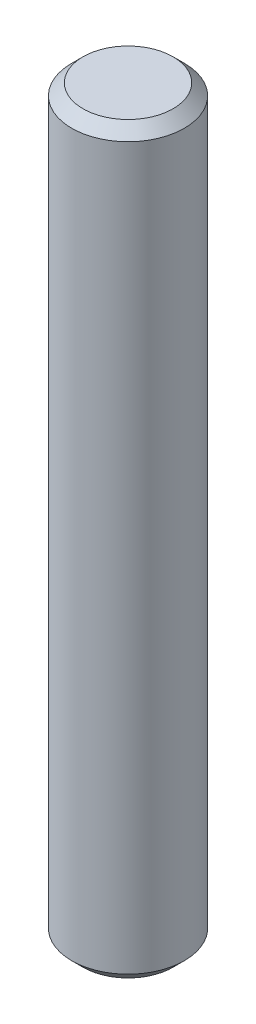
from build123d import *

# Parameters (mm, degrees)
SKETCH1_R           = 3.175
BOSS_EXTRUDE1_DEPTH = 41.91
CHAMFER1_SIZE       = 0.635


with BuildPart() as part:
    # Sketch1 → Boss-Extrude1 (new body)
    with BuildSketch(Plane(origin=(0, 0, 0), x_dir=(1, 0, 0), z_dir=(0, 1, 0))):
        with Locations(Location((0, 0, 0), (0, 0, 270))):
            Circle(SKETCH1_R)
    extrude(amount=BOSS_EXTRUDE1_DEPTH)

    # Chamfer1
    chamfer1_edges = [part.edges().sort_by_distance(p)[0] for p in [
        (0, 0, -3.175),
        (0, 41.91, -3.175),
    ]]
    chamfer(chamfer1_edges, length=CHAMFER1_SIZE)


solid = part.part
